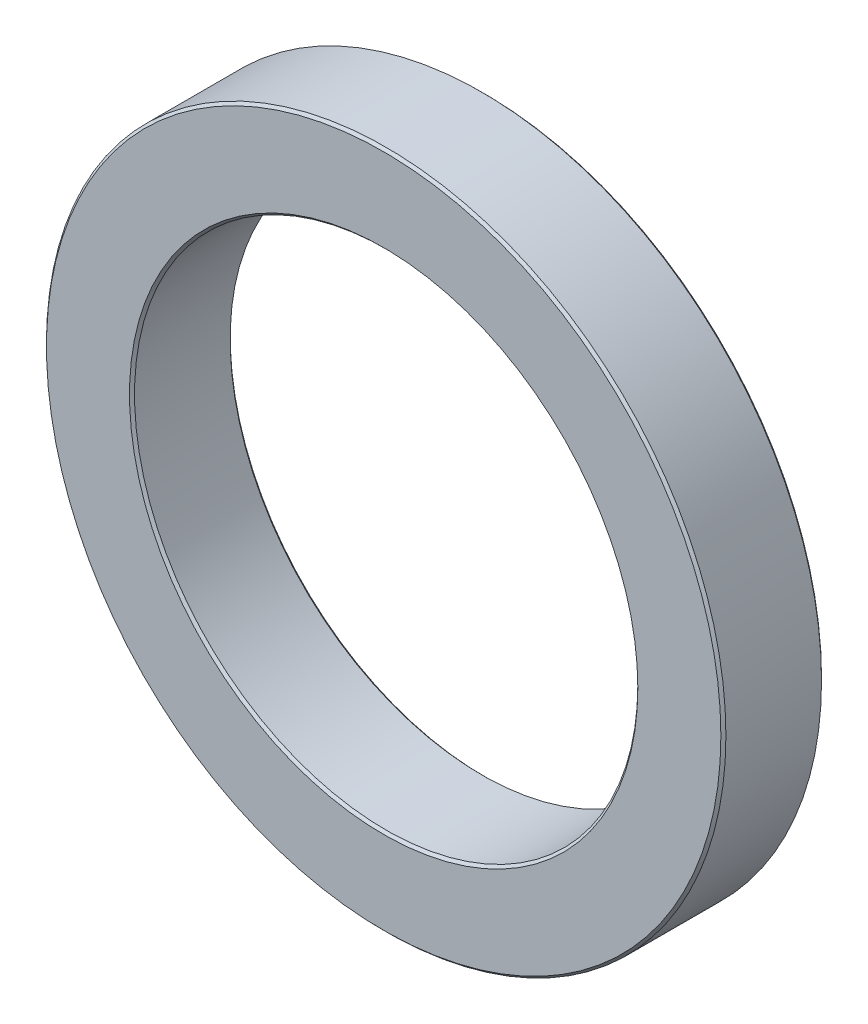
from build123d import *

# Parameters (mm, degrees)
SKETCH_1_R      = 13.5
SKETCH_1_R_2    = 10
EXTRUDE_1_DEPTH = 4
CHAMFER_1_SIZE  = 0.1


with BuildPart() as part:
    # 草图1 → 凸台-拉伸1 (new body)
    with BuildSketch(Plane.XY):
        Circle(SKETCH_1_R)
        Circle(SKETCH_1_R_2, mode=Mode.SUBTRACT)
    extrude(amount=EXTRUDE_1_DEPTH)

    # 倒角1
    chamfer_1_edges = [part.edges().sort_by_distance(p)[0] for p in [
        (-13.5, 0, 0),
        (-13.5, 0, 4),
        (-10, 0, 0),
        (-10, 0, 4),
    ]]
    chamfer(chamfer_1_edges, length=CHAMFER_1_SIZE)


solid = part.part
